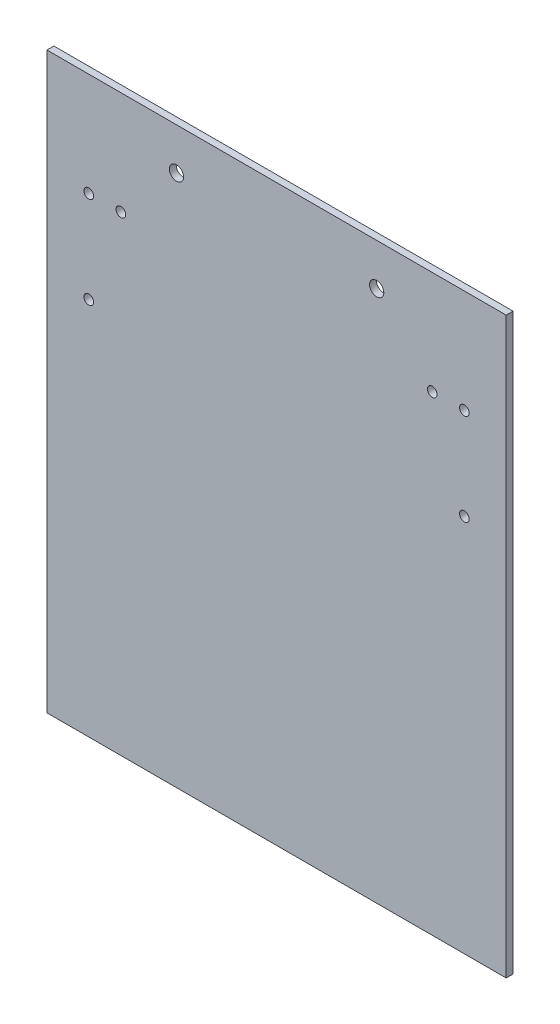
from build123d import *

# Parameters (mm, degrees)
SZKIC1_W                    = 200
SZKIC1_H                    = 250
DODANIE_WYCI_GNI_CIE1_DEPTH = 3
SZKIC2_R                    = 2.1
SZKIC2_R_2                  = 3.1
WYTNIJ_WYCI_GNI_CIE1_DEPTH  = 321.170267202


with BuildPart() as part:
    # Szkic1 → Dodanie-wyciągnięcie1 (new body)
    with BuildSketch(Plane.XY):
        with Locations((100, 125)):
            Rectangle(SZKIC1_W, SZKIC1_H)
    extrude(amount=DODANIE_WYCI_GNI_CIE1_DEPTH)

    # Szkic2 → Wytnij-wyciągnięcie1 (cut, through all)
    with BuildSketch(Plane.XY.offset(3)):
        with Locations((18.2, 165)):
            Circle(SZKIC2_R)
        with Locations((56.4, 231.8)):
            Circle(SZKIC2_R_2)
        with Locations((143.6, 231.8)):
            Circle(SZKIC2_R_2)
        with Locations((167.8, 205)):
            Circle(SZKIC2_R)
        with Locations((181.8, 205)):
            Circle(SZKIC2_R)
        with Locations((18.2, 205)):
            Circle(SZKIC2_R)
        with Locations((32.2, 205)):
            Circle(SZKIC2_R)
        with Locations(Location((181.8, 165, 0), (0, 0, 180))):
            Circle(SZKIC2_R)
    extrude(amount=-WYTNIJ_WYCI_GNI_CIE1_DEPTH, mode=Mode.SUBTRACT)


solid = part.part
